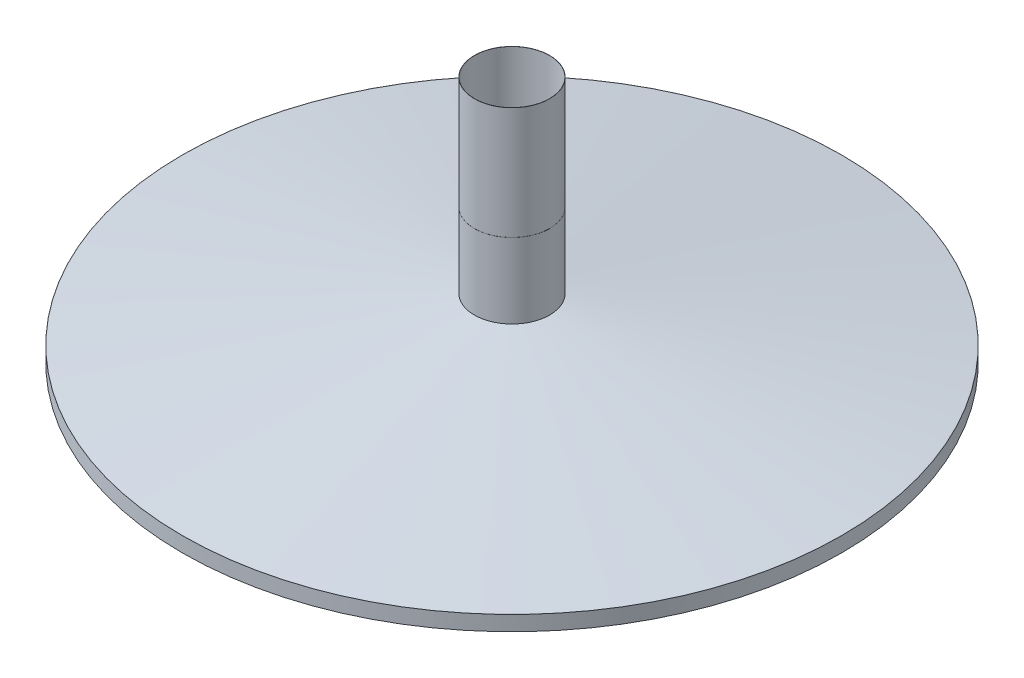
from build123d import *

# Parameters (mm, degrees)
SKETCH1_R                = 4402
SKETCH1_R_2              = 4400
EXTRUDE_THIN1_DEPTH      = 200
SKETCH5_R                = 502
SKETCH5_R_2              = 500
EXTRUDE_THIN2_DEPTH      = 1000
SKETCH7_R                = 450
BOSS_EXTRUDE2_DEPTH      = 2
CUT_EXTRUDE1_DEPTH       = 6341.347939979
CUT_EXTRUDE1_DEPTH_BACK  = 6341.347939979
SKETCH8_R                = 50
EXTRUDE_THIN3_DEPTH      = 300
EXTRUDE_THIN3_2_DEPTH    = 300
EXTRUDE_THIN3_3_DEPTH    = 300
EXTRUDE_THIN3_4_DEPTH    = 300
EXTRUDE_THIN3_5_DEPTH    = 300
EXTRUDE_THIN3_6_DEPTH    = 300
EXTRUDE_THIN3_7_DEPTH    = 300
EXTRUDE_THIN3_8_DEPTH    = 300
SKETCH10_R               = 452
SKETCH10_R_2             = 450
EXTRUDE_THIN4_DEPTH      = 598
SKETCH12_W               = 100
SKETCH12_H               = 298
CUT_EXTRUDE7_DEPTH       = 3
CIRPATTERN1_COUNT        = 8
BOSS_EXTRUDE5_DEPTH      = 1
BOSS_EXTRUDE5_DEPTH_BACK = 1
SKETCH13_R               = 500
CUT_EXTRUDE8_DEPTH       = 10
CUT_EXTRUDE8_DEPTH_BACK  = 2
SKETCH14_R               = 150
SKETCH15_R               = 502
SKETCH15_R_2             = 500
EXTRUDE_THIN5_DEPTH      = 1500
SKETCH16_R               = 4398.797687861
BOSS_EXTRUDE6_DEPTH      = 2


with BuildPart() as part:
    # Sketch1 → Extrude-Thin1 (new body)
    with BuildSketch(Plane(origin=(0, 0, 0), x_dir=(1, 0, 0), z_dir=(0, 1, 0))):
        Circle(SKETCH1_R)
        Circle(SKETCH1_R_2, mode=Mode.SUBTRACT)
    extrude(amount=EXTRUDE_THIN1_DEPTH)


with BuildPart() as body_2:
    # Sketch2 → Revolve1 (revolve)
    with BuildSketch(Plane.XY, mode=Mode.PRIVATE) as revolve1_sk:
        Polygon((-4398.797687861, 196.184971098), (-4400, 200), (-500, 800), (-500, 796), align=None)
    revolve(revolve1_sk.sketch.rotate(Axis((0, 796, 0), (0, -1, 0)), 180), axis=Axis((0, 796, 0), (0, -1, 0)))


with BuildPart() as body_3:
    # Sketch5 → Extrude-Thin2 (new body)
    with BuildSketch(Plane(origin=(0, 800, 0), x_dir=(1, 0, 0), z_dir=(0, 1, 0))):
        Circle(SKETCH5_R)
        Circle(SKETCH5_R_2, mode=Mode.SUBTRACT)
    extrude(amount=EXTRUDE_THIN2_DEPTH)

    # Sketch13 → Boss-Extrude5 (add, two sides: drawn at the far end of the back side and taken through both)
    with BuildSketch(Plane(origin=(0, 1800, 0), x_dir=(1, 0, 0), z_dir=(0, 1, 0)).offset(-BOSS_EXTRUDE5_DEPTH_BACK)):
        with Locations(Location((0, 0, 0), (0, 0, 270))):
            Circle(SKETCH13_R)
    extrude(amount=BOSS_EXTRUDE5_DEPTH + BOSS_EXTRUDE5_DEPTH_BACK)

    # Sketch14 → Cut-Extrude8 (cut, two sides: drawn at the far end of the back side and taken through both)
    with BuildSketch(Plane(origin=(0, 1801, 0), x_dir=(1, 0, 0), z_dir=(0, 1, 0)).offset(-CUT_EXTRUDE8_DEPTH_BACK)):
        with Locations(Location((0, 0, 0), (0, 0, 270))):
            Circle(SKETCH14_R)
    extrude(amount=CUT_EXTRUDE8_DEPTH + CUT_EXTRUDE8_DEPTH_BACK, mode=Mode.SUBTRACT)


with BuildPart() as body_4:
    # Sketch7 → Boss-Extrude2 (new body)
    with BuildSketch(Plane(origin=(0, 1200, 0), x_dir=(1, 0, 0), z_dir=(0, 1, 0))):
        with Locations(Location((0, 0, 0), (0, 0, 270))):
            Circle(SKETCH7_R)
    extrude(amount=BOSS_EXTRUDE2_DEPTH)

    # Sketch8 → Cut-Extrude1 (cut, two sides: drawn at the far end of the back side and taken through both)
    with BuildSketch(Plane(origin=(0, 1202, 0), x_dir=(1, 0, 0), z_dir=(0, 1, 0)).offset(-CUT_EXTRUDE1_DEPTH_BACK)):
        with Locations(Location((0, 0, 0), (0, 0, 270))):
            Circle(SKETCH8_R)
    extrude(amount=CUT_EXTRUDE1_DEPTH + CUT_EXTRUDE1_DEPTH_BACK, mode=Mode.SUBTRACT)


with BuildPart() as body_5:
    # Sketch9 → Extrude-Thin3 (new body)
    with BuildSketch(Plane(origin=(0, 1202, 0), x_dir=(1, 0, 0), z_dir=(0, 1, 0))):
        with BuildLine():
            ThreePointArc((-447.958951492, 49.333333333), (-374.724966329, -19.874663724), (-290.957873884, -75.875))
            Line((-290.957873884, -75.875), (-289.989628047, -74.125))
            ThreePointArc((-289.989628047, -74.125), (-373.477961449, -18.311020916), (-446.468239507, 50.666666667))
            Line((-446.468239507, 50.666666667), (-447.958951492, 49.333333333))
        make_face()
    extrude(amount=EXTRUDE_THIN3_DEPTH)


with BuildPart() as body_6:
    # Sketch9 → Extrude-Thin3 2 (new body)
    with BuildSketch(Plane(origin=(0, 1202, 0), x_dir=(1, 0, 0), z_dir=(0, 1, 0))):
        with BuildLine():
            ThreePointArc((-351.638746832, -281.870877755), (-250.917055278, -279.024074264), (-152.08655864, -259.390012685))
            Line((-152.08655864, -259.390012685), (-152.639342311, -257.467922621))
            ThreePointArc((-152.639342311, -257.467922621), (-251.140952104, -277.036646225), (-351.52746332, -279.87397616))
            Line((-351.52746332, -279.87397616), (-351.638746832, -281.870877755))
        make_face()
    extrude(amount=EXTRUDE_THIN3_2_DEPTH)


with BuildPart() as body_7:
    # Sketch9 → Extrude-Thin3 3 (new body)
    with BuildSketch(Plane(origin=(0, 1202, 0), x_dir=(1, 0, 0), z_dir=(0, 1, 0))):
        with BuildLine():
            ThreePointArc((-49.333333333, -447.958951492), (19.874663724, -374.724966329), (75.875, -290.957873884))
            Line((75.875, -290.957873884), (74.125, -289.989628047))
            ThreePointArc((74.125, -289.989628047), (18.311020917, -373.477961449), (-50.666666667, -446.468239507))
            Line((-50.666666667, -446.468239507), (-49.333333333, -447.958951492))
        make_face()
    extrude(amount=EXTRUDE_THIN3_3_DEPTH)


with BuildPart() as body_8:
    # Sketch9 → Extrude-Thin3 4 (new body)
    with BuildSketch(Plane(origin=(0, 1202, 0), x_dir=(1, 0, 0), z_dir=(0, 1, 0))):
        with BuildLine():
            ThreePointArc((49.333333333, 447.958951492), (-19.874663724, 374.724966329), (-75.875, 290.957873884))
            Line((-75.875, 290.957873884), (-74.125, 289.989628047))
            ThreePointArc((-74.125, 289.989628047), (-18.311020917, 373.477961449), (50.666666667, 446.468239507))
            Line((50.666666667, 446.468239507), (49.333333333, 447.958951492))
        make_face()
    extrude(amount=EXTRUDE_THIN3_4_DEPTH)


with BuildPart() as body_9:
    # Sketch9 → Extrude-Thin3 5 (new body)
    with BuildSketch(Plane(origin=(0, 1202, 0), x_dir=(1, 0, 0), z_dir=(0, 1, 0))):
        with BuildLine():
            ThreePointArc((-281.870877754, 351.638746831), (-279.024074264, 250.917055277), (-259.390012685, 152.08655864))
            Line((-259.390012685, 152.08655864), (-257.467922621, 152.63934231))
            ThreePointArc((-257.467922621, 152.63934231), (-277.036646224, 251.140952103), (-279.873976159, 351.52746332))
            Line((-279.873976159, 351.52746332), (-281.870877754, 351.638746831))
        make_face()
    extrude(amount=EXTRUDE_THIN3_5_DEPTH)


with BuildPart() as body_10:
    # Sketch9 → Extrude-Thin3 6 (new body)
    with BuildSketch(Plane(origin=(0, 1202, 0), x_dir=(1, 0, 0), z_dir=(0, 1, 0))):
        with BuildLine():
            ThreePointArc((351.638746832, 281.870877755), (250.917055278, 279.024074264), (152.08655864, 259.390012685))
            Line((152.08655864, 259.390012685), (152.639342311, 257.467922621))
            ThreePointArc((152.639342311, 257.467922621), (251.140952104, 277.036646225), (351.52746332, 279.87397616))
            Line((351.52746332, 279.87397616), (351.638746832, 281.870877755))
        make_face()
    extrude(amount=EXTRUDE_THIN3_6_DEPTH)


with BuildPart() as body_11:
    # Sketch9 → Extrude-Thin3 7 (new body)
    with BuildSketch(Plane(origin=(0, 1202, 0), x_dir=(1, 0, 0), z_dir=(0, 1, 0))):
        with BuildLine():
            ThreePointArc((447.958951492, -49.333333333), (374.724966329, 19.874663724), (290.957873884, 75.875))
            Line((290.957873884, 75.875), (289.989628047, 74.125))
            ThreePointArc((289.989628047, 74.125), (373.477961449, 18.311020916), (446.468239507, -50.666666667))
            Line((446.468239507, -50.666666667), (447.958951492, -49.333333333))
        make_face()
    extrude(amount=EXTRUDE_THIN3_7_DEPTH)


with BuildPart() as body_12:
    # Sketch9 → Extrude-Thin3 8 (new body)
    with BuildSketch(Plane(origin=(0, 1202, 0), x_dir=(1, 0, 0), z_dir=(0, 1, 0))):
        with BuildLine():
            ThreePointArc((281.870877756, -351.638746833), (279.024074265, -250.917055278), (259.390012686, -152.086558641))
            Line((259.390012686, -152.086558641), (257.467922622, -152.639342311))
            ThreePointArc((257.467922622, -152.639342311), (277.036646225, -251.140952105), (279.873976161, -351.527463321))
            Line((279.873976161, -351.527463321), (281.870877756, -351.638746833))
        make_face()
    extrude(amount=EXTRUDE_THIN3_8_DEPTH)


with BuildPart() as body_13:
    # Sketch10 → Extrude-Thin4 (new body)
    with BuildSketch(Plane(origin=(0, 1202, 0), x_dir=(1, 0, 0), z_dir=(0, 1, 0))):
        Circle(SKETCH10_R)
        Circle(SKETCH10_R_2, mode=Mode.SUBTRACT)
    extrude(amount=EXTRUDE_THIN4_DEPTH)


with BuildPart() as cut_extrude7_tool:
    # Sketch12 → Cut-Extrude7 (new, symmetric)
    with BuildSketch(Plane.XY.offset(450)):
        with Locations((0, 1351)):
            Rectangle(SKETCH12_W, SKETCH12_H)
    cut_extrude7 = extrude(amount=CUT_EXTRUDE7_DEPTH, both=True)


with BuildPart() as body_7_1:
    add(body_7.part)

    # Cut-Extrude7: cut by cut_extrude7_tool
    add(cut_extrude7_tool.part, mode=Mode.SUBTRACT)


with BuildPart() as body_13_1:
    add(body_13.part)

    # Cut-Extrude7: cut by cut_extrude7_tool
    add(cut_extrude7_tool.part, mode=Mode.SUBTRACT)


with BuildPart() as cirpattern1_tool:
    # CirPattern1: Cut-Extrude7 ×8 about axis
    cirpattern1_axis = Axis((0, 0, 0), (0, 1, 0))
    for i in range(1, CIRPATTERN1_COUNT):
        add(cut_extrude7.rotate(cirpattern1_axis, i * 360 / CIRPATTERN1_COUNT))


with BuildPart() as body_5_1:
    add(body_5.part)

    # CirPattern1: cut by cirpattern1_tool
    add(cirpattern1_tool.part, mode=Mode.SUBTRACT)


with BuildPart() as body_6_1:
    add(body_6.part)

    # CirPattern1: cut by cirpattern1_tool
    add(cirpattern1_tool.part, mode=Mode.SUBTRACT)


with BuildPart() as body_8_1:
    add(body_8.part)

    # CirPattern1: cut by cirpattern1_tool
    add(cirpattern1_tool.part, mode=Mode.SUBTRACT)


with BuildPart() as body_9_1:
    add(body_9.part)

    # CirPattern1: cut by cirpattern1_tool
    add(cirpattern1_tool.part, mode=Mode.SUBTRACT)


with BuildPart() as body_10_1:
    add(body_10.part)

    # CirPattern1: cut by cirpattern1_tool
    add(cirpattern1_tool.part, mode=Mode.SUBTRACT)


with BuildPart() as body_11_1:
    add(body_11.part)

    # CirPattern1: cut by cirpattern1_tool
    add(cirpattern1_tool.part, mode=Mode.SUBTRACT)


with BuildPart() as body_12_1:
    add(body_12.part)

    # CirPattern1: cut by cirpattern1_tool
    add(cirpattern1_tool.part, mode=Mode.SUBTRACT)


with BuildPart() as body_13_2:
    add(body_13_1.part)

    # CirPattern1: cut by cirpattern1_tool
    add(cirpattern1_tool.part, mode=Mode.SUBTRACT)


with BuildPart() as body_14:
    # Sketch15 → Extrude-Thin5 (new body)
    with BuildSketch(Plane(origin=(0, 1801, 0), x_dir=(1, 0, 0), z_dir=(0, 1, 0))):
        Circle(SKETCH15_R)
        Circle(SKETCH15_R_2, mode=Mode.SUBTRACT)
    extrude(amount=EXTRUDE_THIN5_DEPTH)


with BuildPart() as body_15:
    # Sketch16 → Boss-Extrude6 (new body)
    with BuildSketch(Plane(origin=(0, 0, 0), x_dir=(1, 0, 0), z_dir=(0, 1, 0))):
        with Locations(Location((0, 0, 0), (0, 0, 270))):
            Circle(SKETCH16_R)
    extrude(amount=-BOSS_EXTRUDE6_DEPTH)


solid = Compound([part.part, body_2.part, body_3.part, body_4.part, body_7_1.part, body_5_1.part, body_6_1.part, body_8_1.part, body_9_1.part, body_10_1.part, body_11_1.part, body_12_1.part, body_13_2.part, body_14.part, body_15.part])
